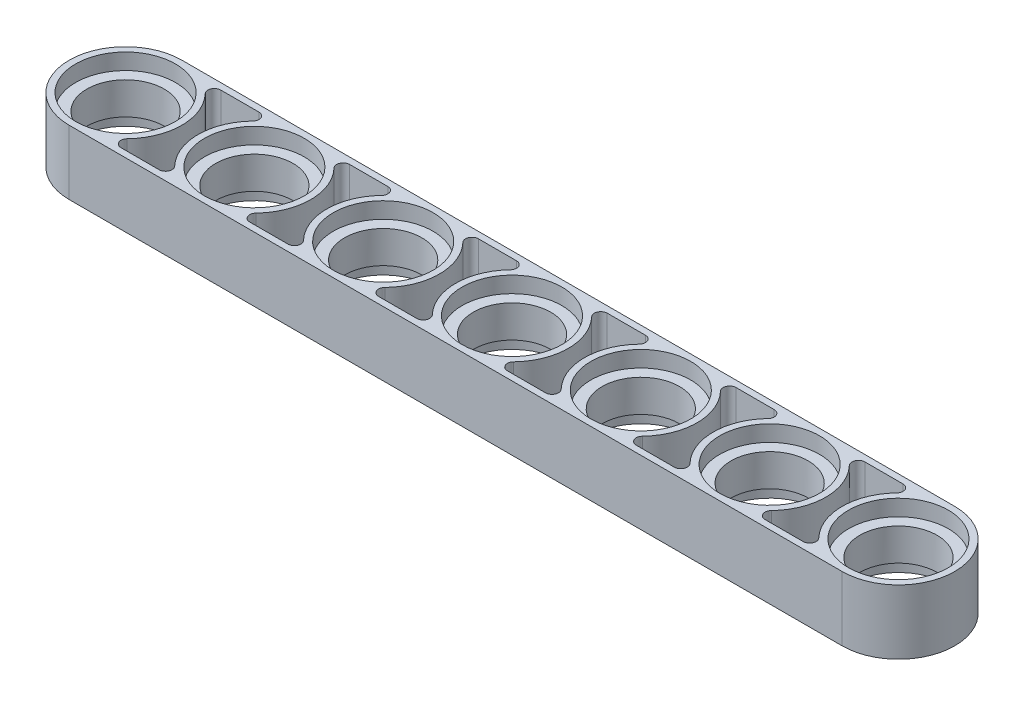
from build123d import *

# Parameters (mm, degrees)
BOSS_EXTRUDE1_DEPTH = 2
SKETCH2_R           = 3.1
CUT_EXTRUDE1_DEPTH  = 1
CUT_EXTRUDE2_START  = -1
SKETCH3_R           = 3.1
CUT_EXTRUDE2_DEPTH  = 1
SKETCH4_R           = 2.4
CUT_EXTRUDE3_DEPTH  = 52.705899083
LPATTERN1_COUNT     = 7
LPATTERN1_PITCH     = 8
CUT_EXTRUDE4_DEPTH  = 52.773545368
LPATTERN2_COUNT     = 6
LPATTERN2_PITCH     = 8


with BuildPart() as part:
    # Sketch1 → Boss-Extrude1 (new, symmetric)
    with BuildSketch(Plane(origin=(0, 0, 0), x_dir=(1, 0, 0), z_dir=(0, 1, 0))):
        with BuildLine():
            Line((0, 3.5), (48, 3.5))
            ThreePointArc((48, 3.5), (51.5, 0), (48, -3.5))
            Line((48, -3.5), (0, -3.5))
            ThreePointArc((0, -3.5), (-3.5, 0), (0, 3.5))
        make_face()
    extrude(amount=BOSS_EXTRUDE1_DEPTH, both=True)

    # Sketch2 → Cut-Extrude1 (cut)
    with BuildSketch(Plane(origin=(0, 2, 0), x_dir=(1, 0, 0), z_dir=(0, 1, 0))):
        with Locations(Location((0, 0, 0), (0, 0, 270))):
            Circle(SKETCH2_R)
    cut_extrude1 = extrude(amount=-CUT_EXTRUDE1_DEPTH, mode=Mode.SUBTRACT)

    # Sketch3 → Cut-Extrude2 (cut)
    with BuildSketch(Plane.XZ.offset(2).offset(CUT_EXTRUDE2_START)):
        with Locations(Location((0, 0, 0), (0, 0, 90))):
            Circle(SKETCH3_R)
    cut_extrude2 = extrude(amount=CUT_EXTRUDE2_DEPTH, mode=Mode.SUBTRACT)

    # Sketch4 → Cut-Extrude3 (cut, through all)
    with BuildSketch(Plane(origin=(0, 1, 0), x_dir=(1, 0, 0), z_dir=(0, 1, 0))):
        with Locations(Location((0, 0, 0), (0, 0, 270))):
            Circle(SKETCH4_R)
    cut_extrude3 = extrude(amount=-CUT_EXTRUDE3_DEPTH, mode=Mode.SUBTRACT)

    # LPattern1: Cut-Extrude1, Cut-Extrude2, Cut-Extrude3 ×7
    with Locations(*[(i * LPATTERN1_PITCH, 0, 0) for i in range(1, LPATTERN1_COUNT)]):
        add(cut_extrude1, mode=Mode.SUBTRACT)
        add(cut_extrude2, mode=Mode.SUBTRACT)
        add(cut_extrude3, mode=Mode.SUBTRACT)

    # Sketch5 → Cut-Extrude4 (cut, through all)
    with BuildSketch(Plane(origin=(0, 2, 0), x_dir=(1, 0, 0), z_dir=(0, 1, 0))):
        with BuildLine():
            Line((2.814249456, 3.1), (5.185750544, 3.1))
            ThreePointArc((5.185750544, 3.1), (5.553697029, 2.856892908), (5.474391514, 2.423076923))
            ThreePointArc((5.474391514, 2.423076923), (4.5, 0), (5.474391514, -2.423076923))
            ThreePointArc((5.474391514, -2.423076923), (5.553697029, -2.856892908), (5.185750544, -3.1))
            Line((5.185750544, -3.1), (2.814249456, -3.1))
            ThreePointArc((2.814249456, -3.1), (2.446302971, -2.856892908), (2.525608486, -2.423076923))
            ThreePointArc((2.525608486, -2.423076923), (3.5, 0), (2.525608486, 2.423076923))
            ThreePointArc((2.525608486, 2.423076923), (2.446302971, 2.856892908), (2.814249456, 3.1))
        make_face()
    cut_extrude4 = extrude(amount=-CUT_EXTRUDE4_DEPTH, mode=Mode.SUBTRACT)

    # LPattern2: Cut-Extrude4 ×6
    with Locations(*[(i * LPATTERN2_PITCH, 0, 0) for i in range(1, LPATTERN2_COUNT)]):
        add(cut_extrude4, mode=Mode.SUBTRACT)


solid = part.part
